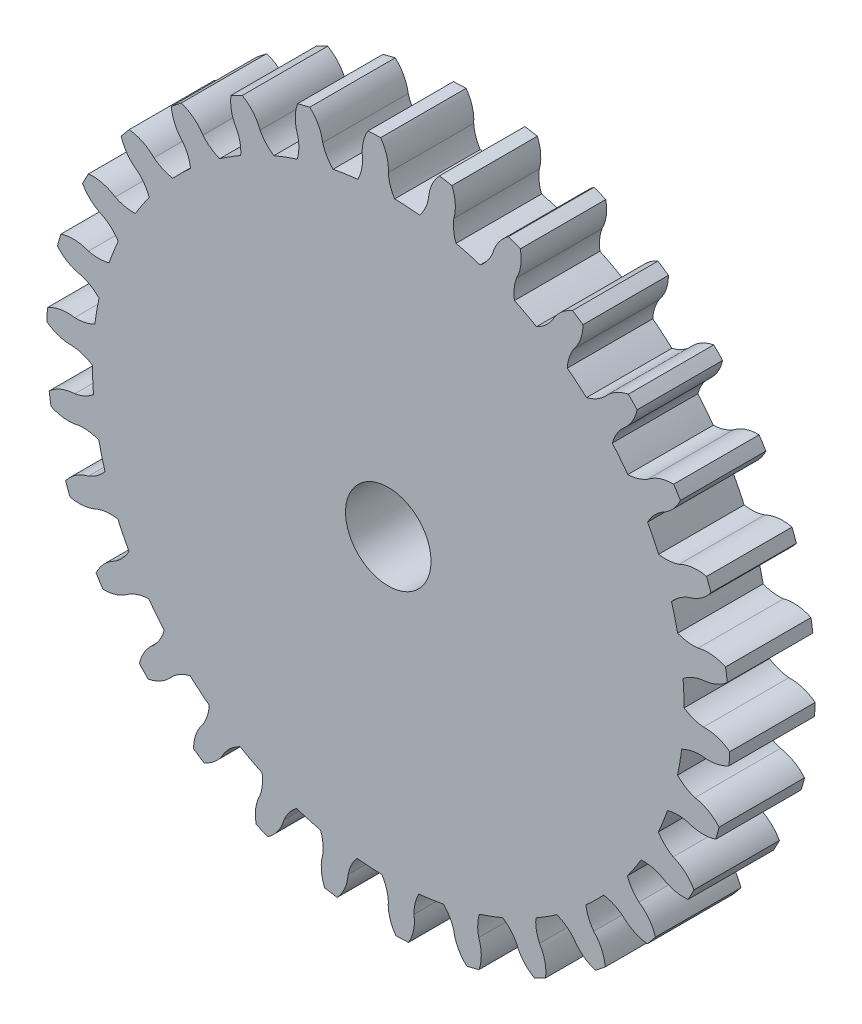
from build123d import *

# Parameters (mm, degrees)
CROQUIS1_R              = 50.8
SALIENTE_EXTRUIR1_DEPTH = 12.7
CORTAR_EXTRUIR1_DEPTH   = 73.955945611
MATRIZC1_COUNT          = 30
CROQUIS2_R              = 6.35
CORTAR_EXTRUIR2_DEPTH   = 73.910766597


with BuildPart() as part:
    # Croquis1 → Saliente-Extruir1 (new body)
    with BuildSketch(Plane.XY):
        Circle(CROQUIS1_R)
    extrude(amount=SALIENTE_EXTRUIR1_DEPTH)

    # Croquis1<4> → Cortar-Extruir1 (cut, through all)
    with BuildSketch(Plane.XY):
        with BuildLine():
            ThreePointArc((0.955394974, 43.944315588), (2.807240173, 43.864963863), (4.654093368, 43.7076088))
            ThreePointArc((4.654093368, 43.7076088), (5.489028455, 45.002576406), (5.97182928, 46.465778738))
            ThreePointArc((5.97182928, 46.465778738), (6.457577611, 48.48824115), (7.596264313, 50.228843989))
            ThreePointArc((7.596264313, 50.228843989), (3.244426667, 50.696288775), (-1.131495496, 50.787397235))
            ThreePointArc((-1.131495496, 50.787397235), (-0.223977186, 48.915842757), (0, 46.847959813))
            ThreePointArc((0, 46.847959813), (0.292344039, 45.335150287), (0.955394974, 43.944315588))
        make_face()
    cortar_extruir1 = extrude(amount=CORTAR_EXTRUIR1_DEPTH, mode=Mode.SUBTRACT)

    # MatrizC1: Cortar-Extruir1 ×30 about axis
    matrizc1_axis = Axis((0, 0, 12.7), (0, 0, 1))
    for i in range(1, MATRIZC1_COUNT):
        add(cortar_extruir1.rotate(matrizc1_axis, i * 360 / MATRIZC1_COUNT), mode=Mode.SUBTRACT)

    # Croquis2 → Cortar-Extruir2 (cut, through all)
    with BuildSketch(Plane.XY.offset(12.7)):
        Circle(CROQUIS2_R)
    extrude(amount=-CORTAR_EXTRUIR2_DEPTH, mode=Mode.SUBTRACT)


solid = part.part
